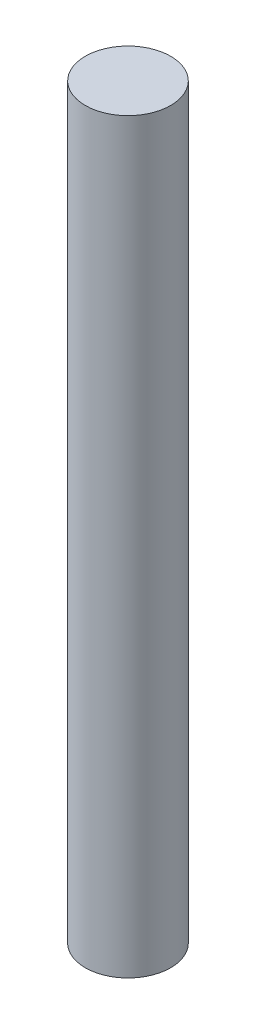
from build123d import *

# Parameters (mm, degrees)
SKETCH1_R           = 2
BOSS_EXTRUDE1_DEPTH = 35


with BuildPart() as part:
    # Sketch1 → Boss-Extrude1 (new body)
    with BuildSketch(Plane(origin=(0, 0, 0), x_dir=(1, 0, 0), z_dir=(0, 1, 0))):
        with Locations(Location((0, 0, 0), (0, 0, 270))):
            Circle(SKETCH1_R)
    extrude(amount=BOSS_EXTRUDE1_DEPTH)


solid = part.part
